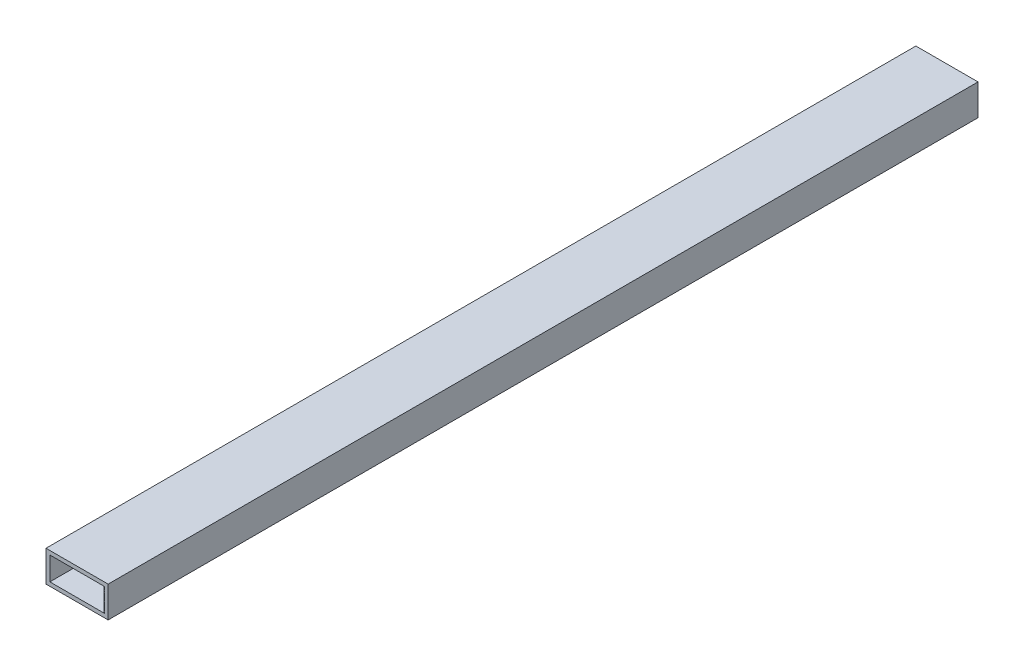
from build123d import *

# Parameters (mm, degrees)
SKETCH1_W           = 50.8
SKETCH1_H           = 25.4
BOSS_EXTRUDE1_DEPTH = 711.2
SHELL1_T            = -3.175


with BuildPart() as part:
    # Sketch1 → Boss-Extrude1 (new body)
    with BuildSketch(Plane.XY):
        Rectangle(SKETCH1_W, SKETCH1_H)
    extrude(amount=BOSS_EXTRUDE1_DEPTH)

    # Shell1
    shell1_openings = [part.faces().sort_by_distance(p)[0] for p in [
        (0, 0, 711.2),
        (0, 0, 0),
    ]]
    offset(amount=SHELL1_T, openings=shell1_openings, kind=Kind.INTERSECTION)


solid = part.part
